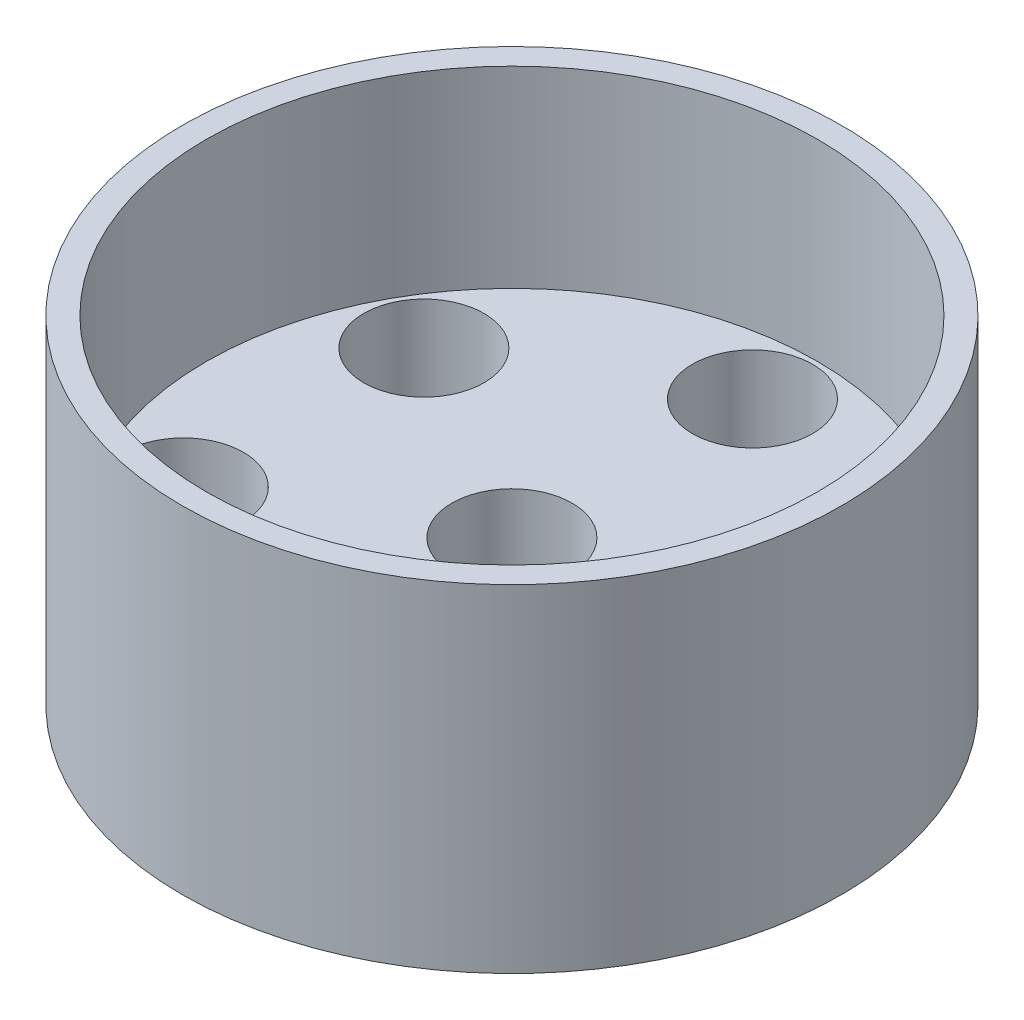
from build123d import *

# Parameters (mm, degrees)
SKETCH1_R                       = 13.1
SKETCH1_R_2                     = 2.5
BOSS_EXTRUDE1_DEPTH             = 6
SKETCH2_R                       = 13.7
SKETCH2_R_2                     = 12.7
BOSS_EXTRUDE2_DEPTH             = 8
BOSS_EXTRUDE2_DIRECTION_2_REACH = 21.474
SKETCH7_R                       = 2.5
CUT_EXTRUDE4_DEPTH              = 6


with BuildPart() as part:
    # Sketch1 → Boss-Extrude1 (new body)
    with BuildSketch(Plane(origin=(0, 0, 0), x_dir=(1, 0, 0), z_dir=(0, 1, 0))):
        with Locations(Location((0, 0, 0), (0, 0, 270))):
            Circle(SKETCH1_R)
        with Locations(Location((0, 0, 0), (0, 0, 270))):
            Circle(SKETCH1_R_2, mode=Mode.SUBTRACT)
    extrude(amount=BOSS_EXTRUDE1_DEPTH)

    # Sketch2 → Boss-Extrude2 (add)
    with BuildSketch(Plane(origin=(0, 6, 0), x_dir=(1, 0, 0), z_dir=(0, 1, 0))):
        with Locations(Location((0, 0, 0), (0, 0, 270))):
            Circle(SKETCH2_R)
        with Locations(Location((0, 0, 0), (0, 0, 270))):
            Circle(SKETCH2_R_2, mode=Mode.SUBTRACT)
    extrude(amount=BOSS_EXTRUDE2_DEPTH)

    # Boss-Extrude2 direction 2: up to this face of the body (flat: up to its plane)
    boss_extrude2_direction_2_end = Plane(part.part.faces().sort_by_distance((0, 0, -12.729476047))[0])
    # Sketch2 → Boss-Extrude2 direction 2 (add, up to the picked face)
    with BuildSketch(Plane(origin=(0, 6, 0), x_dir=(1, 0, 0), z_dir=(0, 1, 0)), mode=Mode.PRIVATE) as boss_extrude2_direction_2_sk1:
        with Locations(Location((0, 0, 0), (0, 0, 270))):
            Circle(SKETCH2_R)
        with Locations(Location((0, 0, 0), (0, 0, 270))):
            Circle(SKETCH2_R_2, mode=Mode.SUBTRACT)
    boss_extrude2_direction_2_tool1 = split(extrude(boss_extrude2_direction_2_sk1.sketch, amount=-BOSS_EXTRUDE2_DIRECTION_2_REACH, mode=Mode.PRIVATE), bisect_by=boss_extrude2_direction_2_end, keep=Keep.BOTH, mode=Mode.PRIVATE)
    add(boss_extrude2_direction_2_tool1.solids().sort_by(Axis((0, 6, -13.312505), (0, -1, 0)))[0])

    # Sketch7 → Cut-Extrude4 (cut)
    with BuildSketch(Plane(origin=(0, 6, 0), x_dir=(1, 0, 0), z_dir=(0, 1, 0))):
        with Locations(Location((0, 10, 0), (0, 0, 270))):
            Circle(SKETCH7_R)
        with Locations(Location((8.660254038, 5, 0), (0, 0, 270))):
            Circle(SKETCH7_R)
        with Locations(Location((8.660254038, -5, 0), (0, 0, 270))):
            Circle(SKETCH7_R)
        with Locations(Location((0, -10, 0), (0, 0, 270))):
            Circle(SKETCH7_R)
        with Locations(Location((-8.660254038, -5, 0), (0, 0, 270))):
            Circle(SKETCH7_R)
        with Locations(Location((-8.660254038, 5, 0), (0, 0, 270))):
            Circle(SKETCH7_R)
    extrude(amount=-CUT_EXTRUDE4_DEPTH, mode=Mode.SUBTRACT)


solid = part.part
